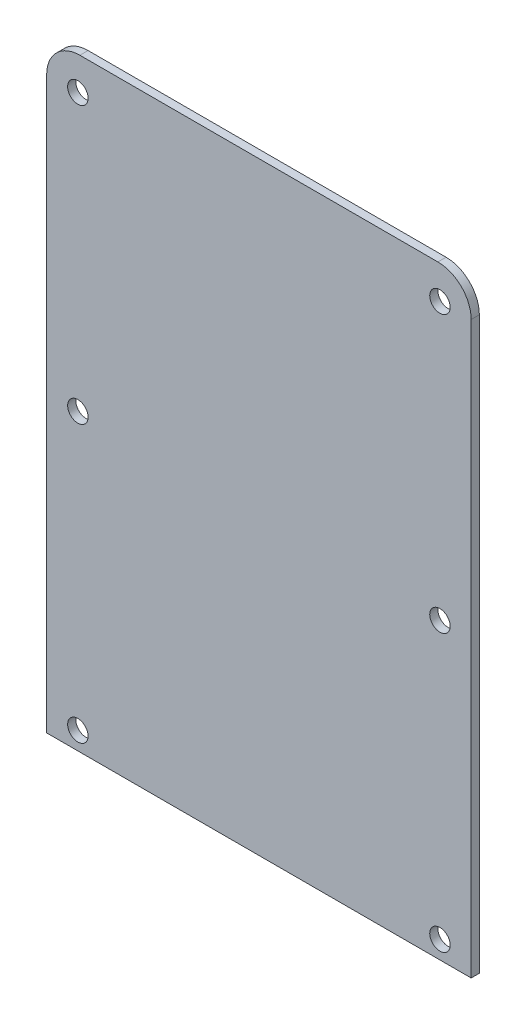
from build123d import *

# Parameters (mm, degrees)
EXTRUDE_1_DEPTH     = 0.8
SKETCH_2_R          = 1
CUT_EXTRUDE_1_DEPTH = 81.091837911


with BuildPart() as part:
    # 草图1 → 凸台-拉伸1 (new body)
    with BuildSketch(Plane.XY):
        with BuildLine():
            Line((-41.75, 66.25), (-6.75, 66.25))
            ThreePointArc((-6.75, 66.25), (-4.451902961, 65.298097039), (-3.5, 63))
            Line((-3.5, 63), (-3.5, 7.25))
            Line((-3.5, 7.25), (-45, 7.25))
            Line((-45, 7.25), (-45, 63))
            ThreePointArc((-45, 63), (-44.048097039, 65.298097039), (-41.75, 66.25))
        make_face()
    extrude(amount=EXTRUDE_1_DEPTH)

    # 草图2 → 切除-拉伸1 (cut, through all)
    with BuildSketch(Plane.XY.offset(0.8)):
        with Locations((-41.95, 63)):
            Circle(SKETCH_2_R)
        with Locations((-41.95, 36)):
            Circle(SKETCH_2_R)
        with Locations((-41.95, 9)):
            Circle(SKETCH_2_R)
        with Locations(Location((-6.55, 9, 0), (0, 0, 180))):
            Circle(SKETCH_2_R)
        with Locations(Location((-6.55, 36, 0), (0, 0, 180))):
            Circle(SKETCH_2_R)
        with Locations(Location((-6.55, 63, 0), (0, 0, 180))):
            Circle(SKETCH_2_R)
    extrude(amount=-CUT_EXTRUDE_1_DEPTH, mode=Mode.SUBTRACT)


solid = part.part
